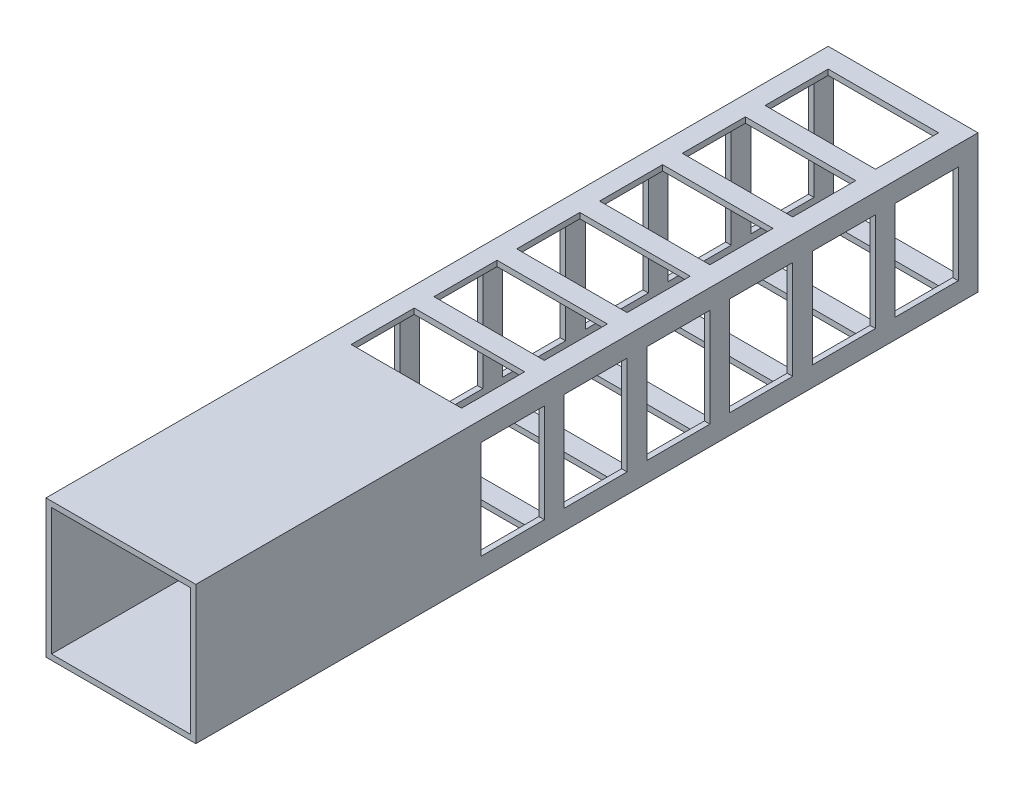
from build123d import *

# Parameters (mm, degrees)
SKETCH1_W           = 190
SKETCH1_H           = 175
SKETCH1_W_2         = 176
SKETCH1_H_2         = 161
BOSS_EXTRUDE1_DEPTH = 496
SKETCH2_W           = 80
SKETCH2_H           = 125
CUT_EXTRUDE1_DEPTH  = 540.487024867
SKETCH5_W           = 140
SKETCH5_H           = 80
CUT_EXTRUDE2_DEPTH  = 535.477314766


with BuildPart() as part:
    # Sketch1 → Boss-Extrude1 (new, symmetric)
    with BuildSketch(Plane.XY):
        with Locations((0, 7)):
            Rectangle(SKETCH1_W, SKETCH1_H)
        with Locations((0, 7)):
            Rectangle(SKETCH1_W_2, SKETCH1_H_2, mode=Mode.SUBTRACT)
    extrude(amount=BOSS_EXTRUDE1_DEPTH, both=True)

    # Sketch2 → Cut-Extrude1 (cut, through all)
    with BuildSketch(Plane(origin=(95, 0, 0), x_dir=(0, 0, -1), z_dir=(1, 0, 0))):
        with Locations((431, 7)):
            Rectangle(SKETCH2_W, SKETCH2_H)
        with Locations((326, 7)):
            Rectangle(SKETCH2_W, SKETCH2_H)
        with Locations((221, 7)):
            Rectangle(SKETCH2_W, SKETCH2_H)
        with Locations((116, 7)):
            Rectangle(SKETCH2_W, SKETCH2_H)
        with Locations((11, 7)):
            Rectangle(SKETCH2_W, SKETCH2_H)
        with Locations((-94, 7)):
            Rectangle(SKETCH2_W, SKETCH2_H)
    extrude(amount=-CUT_EXTRUDE1_DEPTH, mode=Mode.SUBTRACT)

    # Sketch5 → Cut-Extrude2 (cut, through all)
    with BuildSketch(Plane(origin=(0, 94.5, 0), x_dir=(1, 0, 0), z_dir=(0, 1, 0))):
        with Locations((0, 431)):
            Rectangle(SKETCH5_W, SKETCH5_H)
        with Locations((0, 326)):
            Rectangle(SKETCH5_W, SKETCH5_H)
        with Locations((0, 221)):
            Rectangle(SKETCH5_W, SKETCH5_H)
        with Locations((0, 116)):
            Rectangle(SKETCH5_W, SKETCH5_H)
        with Locations((0, 11)):
            Rectangle(SKETCH5_W, SKETCH5_H)
        with Locations((0, -94)):
            Rectangle(SKETCH5_W, SKETCH5_H)
    extrude(amount=-CUT_EXTRUDE2_DEPTH, mode=Mode.SUBTRACT)


solid = part.part
